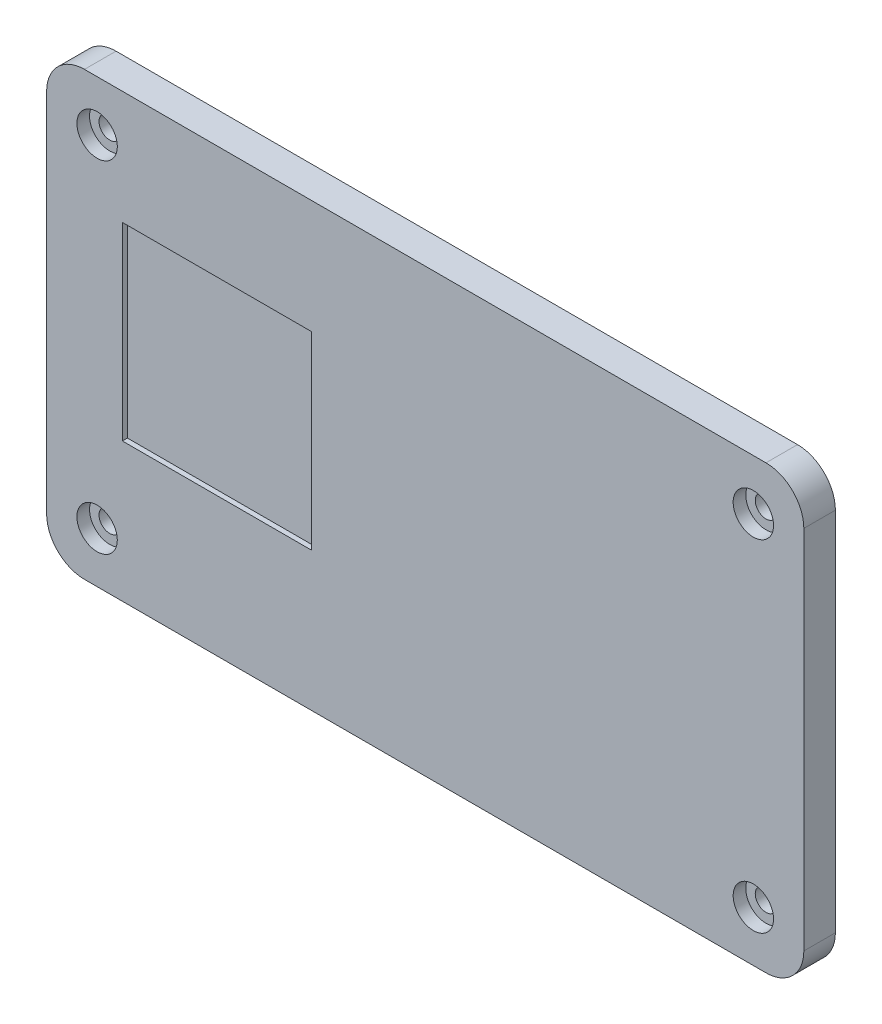
from build123d import *

# Parameters (mm, degrees)
SKETCH1_W           = 120
SKETCH1_H           = 70
BOSS_EXTRUDE1_DEPTH = 5
FILLET1_R           = 6
BOSS_EXTRUDE2_DEPTH = 3
SKETCH3_R           = 5.5
CUT_EXTRUDE1_DEPTH  = 2
SKETCH4_R           = 3.2
CUT_EXTRUDE2_DEPTH  = 2
SKETCH5_R           = 1.7
CUT_EXTRUDE3_DEPTH  = 70.720872054
CUT_EXTRUDE4_DEPTH  = 1
SKETCH7_W           = 30
SKETCH7_H           = 30
CUT_EXTRUDE5_DEPTH  = 0.8


with BuildPart() as part:
    # Sketch1 → Boss-Extrude1 (new body)
    with BuildSketch(Plane.XY):
        Rectangle(SKETCH1_W, SKETCH1_H)
    extrude(amount=BOSS_EXTRUDE1_DEPTH)

    # Fillet1
    fillet1_edges = [part.edges().sort_by_distance(p)[0] for p in [
        (-60, 35, 2.5),
        (60, 35, 2.5),
        (60, -35, 2.5),
        (-60, -35, 2.5),
    ]]
    fillet(fillet1_edges, radius=FILLET1_R)

    # Sketch2 → Boss-Extrude2 (add)
    with BuildSketch(Plane(origin=(0, 0, 0), x_dir=(-1, 0, 0), z_dir=(0, 0, -1))):
        with BuildLine():
            Line((-53.75, 31.75), (53.75, 31.75))
            ThreePointArc((53.75, 31.75), (55.871320344, 30.871320344), (56.75, 28.75))
            Line((56.75, 28.75), (56.75, -28.75))
            ThreePointArc((56.75, -28.75), (55.871320344, -30.871320344), (53.75, -31.75))
            Line((53.75, -31.75), (-53.75, -31.75))
            ThreePointArc((-53.75, -31.75), (-55.871320344, -30.871320344), (-56.75, -28.75))
            Line((-56.75, -28.75), (-56.75, 28.75))
            ThreePointArc((-56.75, 28.75), (-55.871320344, 30.871320344), (-53.75, 31.75))
        make_face()
        with BuildLine():
            Line((-51.75, 29.75), (51.75, 29.75))
            ThreePointArc((51.75, 29.75), (53.871320344, 28.871320344), (54.75, 26.75))
            Line((54.75, 26.75), (54.75, -26.75))
            ThreePointArc((54.75, -26.75), (53.871320344, -28.871320344), (51.75, -29.75))
            Line((51.75, -29.75), (-51.75, -29.75))
            ThreePointArc((-51.75, -29.75), (-53.871320344, -28.871320344), (-54.75, -26.75))
            Line((-54.75, -26.75), (-54.75, 26.75))
            ThreePointArc((-54.75, 26.75), (-53.871320344, 28.871320344), (-51.75, 29.75))
        make_face(mode=Mode.SUBTRACT)
    extrude(amount=BOSS_EXTRUDE2_DEPTH)

    # Sketch3 → Cut-Extrude1 (cut)
    with BuildSketch(Plane(origin=(0, 0, -3), x_dir=(-1, 0, 0), z_dir=(0, 0, -1))):
        with Locations((-52, 27)):
            Circle(SKETCH3_R)
        with Locations((-52, -27)):
            Circle(SKETCH3_R)
        with Locations((52, -27)):
            Circle(SKETCH3_R)
        with Locations((52, 27)):
            Circle(SKETCH3_R)
    extrude(amount=-CUT_EXTRUDE1_DEPTH, mode=Mode.SUBTRACT)

    # Sketch4 → Cut-Extrude2 (cut)
    with BuildSketch(Plane.XY.offset(5)):
        with Locations((52, 27)):
            Circle(SKETCH4_R)
        with Locations(Location((52, -27, 0), (0, 0, 180))):
            Circle(SKETCH4_R)
        with Locations((-52, -27)):
            Circle(SKETCH4_R)
        with Locations(Location((-52, 27, 0), (0, 0, 180))):
            Circle(SKETCH4_R)
    extrude(amount=-CUT_EXTRUDE2_DEPTH, mode=Mode.SUBTRACT)

    # Sketch5 → Cut-Extrude3 (cut, through all)
    with BuildSketch(Plane.XY.offset(3)):
        with Locations((52, 27)):
            Circle(SKETCH5_R)
        with Locations((52, -27)):
            Circle(SKETCH5_R)
        with Locations((-52, -27)):
            Circle(SKETCH5_R)
        with Locations((-52, 27)):
            Circle(SKETCH5_R)
    extrude(amount=-CUT_EXTRUDE3_DEPTH, mode=Mode.SUBTRACT)

    # Sketch6 → Cut-Extrude4 (cut)
    with BuildSketch(Plane(origin=(0, 0, 0), x_dir=(-1, 0, 0), z_dir=(0, 0, -1))):
        with BuildLine():
            Line((-54, 34.1), (54, 34.1))
            ThreePointArc((54, 34.1), (57.606244584, 32.606244584), (59.1, 29))
            Line((59.1, 29), (59.1, -29))
            ThreePointArc((59.1, -29), (57.606244584, -32.606244584), (54, -34.1))
            Line((54, -34.1), (-54, -34.1))
            ThreePointArc((-54, -34.1), (-57.606244584, -32.606244584), (-59.1, -29))
            Line((-59.1, -29), (-59.1, 29))
            ThreePointArc((-59.1, 29), (-57.606244584, 32.606244584), (-54, 34.1))
        make_face()
        with BuildLine():
            Line((-54, 32.9), (54, 32.9))
            ThreePointArc((54, 32.9), (56.757716447, 31.757716447), (57.9, 29))
            Line((57.9, 29), (57.9, -29))
            ThreePointArc((57.9, -29), (56.757716447, -31.757716447), (54, -32.9))
            Line((54, -32.9), (-54, -32.9))
            ThreePointArc((-54, -32.9), (-56.757716447, -31.757716447), (-57.9, -29))
            Line((-57.9, -29), (-57.9, 29))
            ThreePointArc((-57.9, 29), (-56.757716447, 31.757716447), (-54, 32.9))
        make_face(mode=Mode.SUBTRACT)
    extrude(amount=-CUT_EXTRUDE4_DEPTH, mode=Mode.SUBTRACT)

    # Sketch7 → Cut-Extrude5 (cut)
    with BuildSketch(Plane.XY.offset(5)):
        with Locations((-33, 2)):
            Rectangle(SKETCH7_W, SKETCH7_H)
    extrude(amount=-CUT_EXTRUDE5_DEPTH, mode=Mode.SUBTRACT)


solid = part.part
